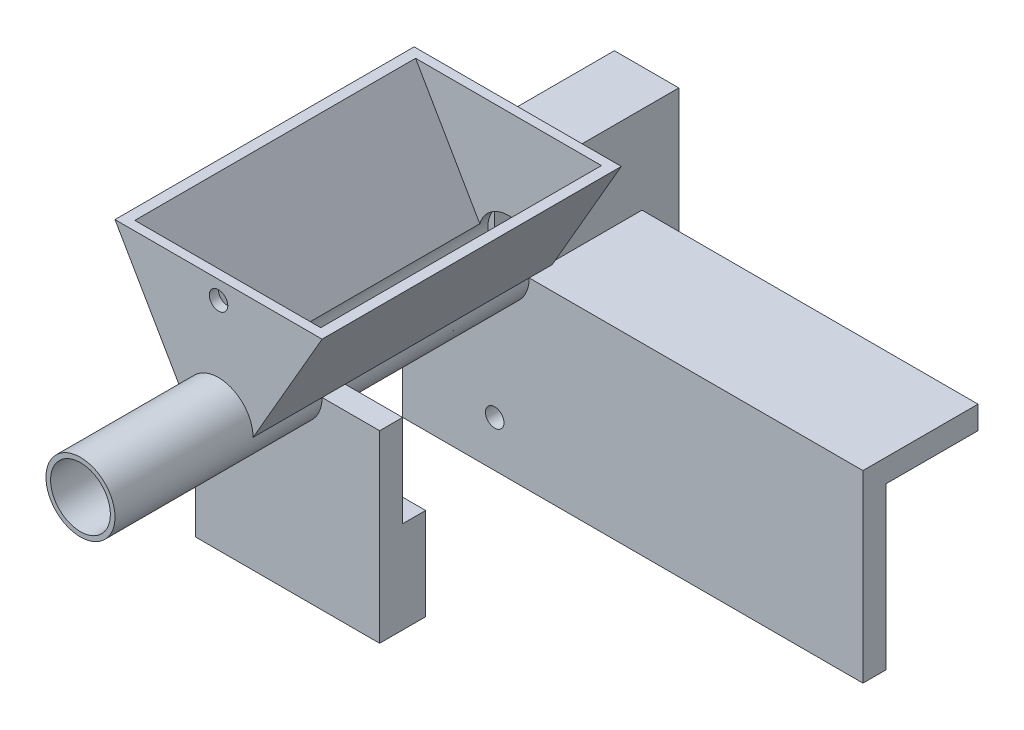
from build123d import *

# Parameters (mm, degrees)
BOSS_EXTRUDE1_DEPTH         = 41.275
SHELL1_T                    = -2.54
BOSS_EXTRUDE2_START         = 38.1
SKETCH3_R                   = 9.525
BOSS_EXTRUDE2_DEPTH         = 38.1
SKETCH5_W                   = 127
SKETCH5_H                   = 50.8
BOSS_EXTRUDE3_DEPTH         = 6.35
SKETCH6_W                   = 50.8
SKETCH6_H                   = 50.8
BOSS_EXTRUDE4_DEPTH         = 6.35
SKETCH4_R                   = 8.255
CUT_EXTRUDE1_DEPTH          = 166.709452054
F_1_4_20_TAPPED_HOLE1_D     = 5.1054
F_1_4_20_TAPPED_HOLE1_DEPTH = 2.54
F_1_4_20_TAPPED_HOLE2_D     = 5.1054
F_1_4_20_TAPPED_HOLE2_DEPTH = 6.35
SKETCH24_W                  = 50.8
SKETCH24_H                  = 25.4
BOSS_EXTRUDE5_DEPTH         = 6.35
SKETCH25_W                  = 17.78
SKETCH25_H                  = 38.1
BOSS_EXTRUDE6_DEPTH         = 35.56
SKETCH26_W                  = 12.7
SKETCH26_H                  = 35.56
CUT_EXTRUDE2_DEPTH          = 35.56
SKETCH27_W                  = 12.7
SKETCH27_H                  = 5.08
BOSS_EXTRUDE7_DEPTH         = 11.43
SKETCH28_W                  = 92.71
SKETCH28_H                  = 6.35
BOSS_EXTRUDE8_DEPTH         = 25.4


with BuildPart() as part:
    # Sketch2 → Boss-Extrude1 (new, symmetric)
    with BuildSketch(Plane.XY):
        with BuildLine():
            Line((9.525, 0), (28.575, 32.995567884))
            Line((28.575, 32.995567884), (-28.575, 32.995567884))
            Line((-28.575, 32.995567884), (-9.525, 0))
            ThreePointArc((-9.525, 0), (0, -9.525), (9.525, 0))
        make_face()
    extrude(amount=BOSS_EXTRUDE1_DEPTH, both=True)

    # Shell1
    shell1_openings = [part.faces().sort_by_distance(p)[0] for p in [
        (0, 32.995567884, 0),
    ]]
    offset(amount=SHELL1_T, openings=shell1_openings, kind=Kind.INTERSECTION)

    # Sketch3 → Boss-Extrude2 (add)
    with BuildSketch(Plane.XY.offset(41.275).offset(BOSS_EXTRUDE2_START)):
        Circle(SKETCH3_R)
    extrude(amount=-BOSS_EXTRUDE2_DEPTH)

    # Sketch5 → Boss-Extrude3 (add)
    with BuildSketch(Plane(origin=(0, 0, -41.275), x_dir=(-1, 0, 0), z_dir=(0, 0, -1))):
        with Locations((-38.1, -25.4)):
            Rectangle(SKETCH5_W, SKETCH5_H)
    extrude(amount=-BOSS_EXTRUDE3_DEPTH)

    # Sketch6 → Boss-Extrude4 (add)
    with BuildSketch(Plane.XY.offset(15.875)):
        with Locations((0, -25.4)):
            Rectangle(SKETCH6_W, SKETCH6_H)
    extrude(amount=BOSS_EXTRUDE4_DEPTH)

    # Sketch4 → Cut-Extrude1 (cut, through all)
    with BuildSketch(Plane.XY.offset(79.375)):
        Circle(SKETCH4_R)
    extrude(amount=-CUT_EXTRUDE1_DEPTH, mode=Mode.SUBTRACT)

    # 1/4-20 Tapped Hole1
    with Locations(Plane.XY.offset(41.275)):
        with Locations((0, 27.968080693)):
            Hole(F_1_4_20_TAPPED_HOLE1_D / 2, depth=F_1_4_20_TAPPED_HOLE1_DEPTH)

    # 1/4-20 Tapped Hole2
    with Locations(Plane(origin=(0, 0, -41.275), x_dir=(-1, 0, 0), z_dir=(0, 0, -1))):
        with Locations((0, -38.1)):
            Hole(F_1_4_20_TAPPED_HOLE2_D / 2, depth=F_1_4_20_TAPPED_HOLE2_DEPTH)

    # Sketch24 → Boss-Extrude5 (add)
    with BuildSketch(Plane(origin=(0, 0, 15.875), x_dir=(-1, 0, 0), z_dir=(0, 0, -1))):
        with Locations((0, -38.1)):
            Rectangle(SKETCH24_W, SKETCH24_H)
    extrude(amount=BOSS_EXTRUDE5_DEPTH)

    # Sketch25 → Boss-Extrude6 (add)
    with BuildSketch(Plane(origin=(0, 0, -41.275), x_dir=(-1, 0, 0), z_dir=(0, 0, -1))):
        with Locations((0, 5.08)):
            Rectangle(SKETCH25_W, SKETCH25_H)
    extrude(amount=BOSS_EXTRUDE6_DEPTH)

    # Sketch26 → Cut-Extrude2 (cut)
    with BuildSketch(Plane(origin=(0, 0, -76.835), x_dir=(-1, 0, 0), z_dir=(0, 0, -1))):
        with Locations((0, 3.81)):
            Rectangle(SKETCH26_W, SKETCH26_H)
    extrude(amount=-CUT_EXTRUDE2_DEPTH, mode=Mode.SUBTRACT)

    # Sketch27 → Boss-Extrude7 (add)
    with BuildSketch(Plane(origin=(0, 0, -41.275), x_dir=(-1, 0, 0), z_dir=(0, 0, -1))):
        with Locations((0, 19.05)):
            Rectangle(SKETCH27_W, SKETCH27_H)
        with Locations((0, -8.89)):
            Rectangle(SKETCH27_W, SKETCH27_H)
    extrude(amount=BOSS_EXTRUDE7_DEPTH)

    # Sketch28 → Boss-Extrude8 (add)
    with BuildSketch(Plane(origin=(0, 0, -41.275), x_dir=(-1, 0, 0), z_dir=(0, 0, -1))):
        with Locations((-55.245, -3.175)):
            Rectangle(SKETCH28_W, SKETCH28_H)
    extrude(amount=BOSS_EXTRUDE8_DEPTH)


solid = part.part
